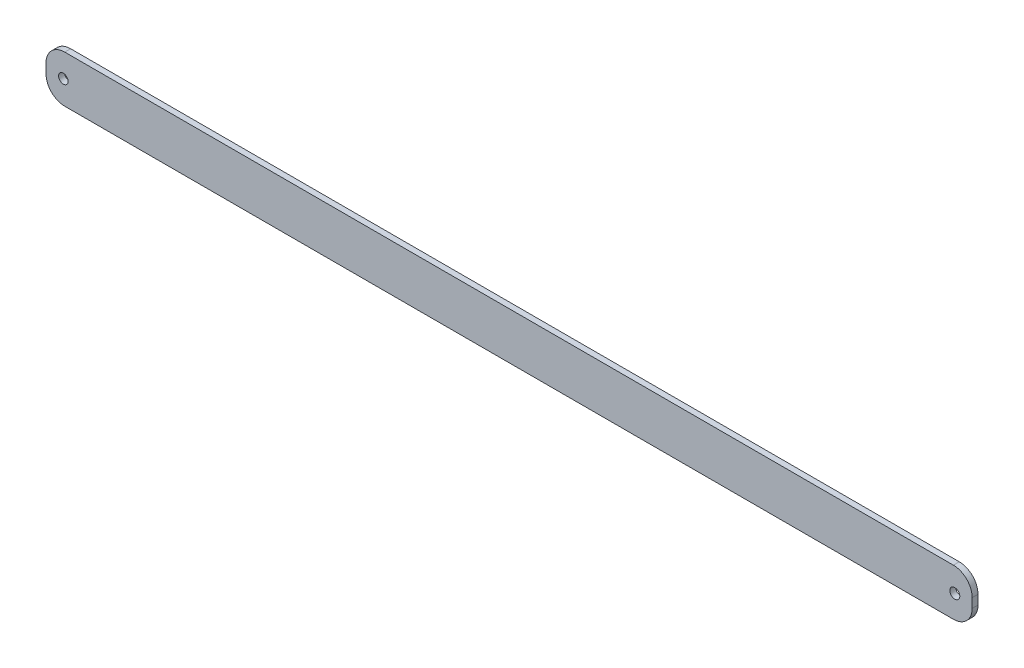
from build123d import *

# Parameters (mm, degrees)
SKETCH1_W           = 501.65
SKETCH1_H           = 25.4
BOSS_EXTRUDE1_DEPTH = 3.175
FILLET1_R           = 10.16
FILLET2_R           = 10.16
FILLET3_R           = 10.16
FILLET4_R           = 10.16
SKETCH2_R           = 2.575820617
CUT_EXTRUDE1_DEPTH  = 503.302660878
SKETCH3_R           = 2.715891218
CUT_EXTRUDE2_DEPTH  = 503.302660878


with BuildPart() as part:
    # Sketch1 → Boss-Extrude1 (new body)
    with BuildSketch(Plane.XY):
        with Locations((-250.825, -12.7)):
            Rectangle(SKETCH1_W, SKETCH1_H)
    extrude(amount=BOSS_EXTRUDE1_DEPTH)

    # Fillet1
    fillet1_edges = [part.edges().sort_by_distance(p)[0] for p in [
        (0, 0, 1.5875),
    ]]
    fillet(fillet1_edges, radius=FILLET1_R)

    # Fillet2
    fillet2_edges = [part.edges().sort_by_distance(p)[0] for p in [
        (0, -25.4, 1.5875),
    ]]
    fillet(fillet2_edges, radius=FILLET2_R)

    # Fillet3
    fillet3_edges = [part.edges().sort_by_distance(p)[0] for p in [
        (-501.65, -25.4, 1.5875),
    ]]
    fillet(fillet3_edges, radius=FILLET3_R)

    # Fillet4
    fillet4_edges = [part.edges().sort_by_distance(p)[0] for p in [
        (-501.65, 0, 1.5875),
    ]]
    fillet(fillet4_edges, radius=FILLET4_R)

    # Sketch2 → Cut-Extrude1 (cut, through all)
    with BuildSketch(Plane.XY.offset(3.175)):
        with Locations((-492.252, -12.843347419)):
            Circle(SKETCH2_R)
    extrude(amount=-CUT_EXTRUDE1_DEPTH, mode=Mode.SUBTRACT)

    # Sketch3 → Cut-Extrude2 (cut, through all)
    with BuildSketch(Plane(origin=(0, 0, 0), x_dir=(-1, 0, 0), z_dir=(0, 0, -1))):
        with Locations((9.398, -12.860909178)):
            Circle(SKETCH3_R)
    extrude(amount=-CUT_EXTRUDE2_DEPTH, mode=Mode.SUBTRACT)


solid = part.part
